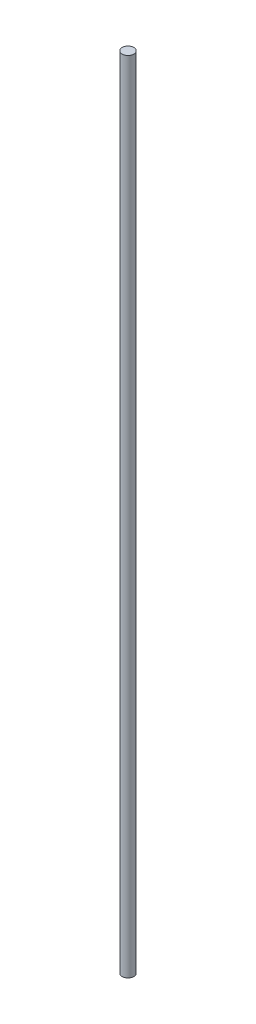
from build123d import *

# Parameters (mm, degrees)
SKETCH1_R           = 2
BOSS_EXTRUDE1_DEPTH = 275


with BuildPart() as part:
    # Sketch1 → Boss-Extrude1 (new body)
    with BuildSketch(Plane(origin=(0, 0, 0), x_dir=(1, 0, 0), z_dir=(0, 1, 0))):
        with Locations(Location((0, 0, 0), (0, 0, 270))):
            Circle(SKETCH1_R)
    extrude(amount=BOSS_EXTRUDE1_DEPTH)


solid = part.part
